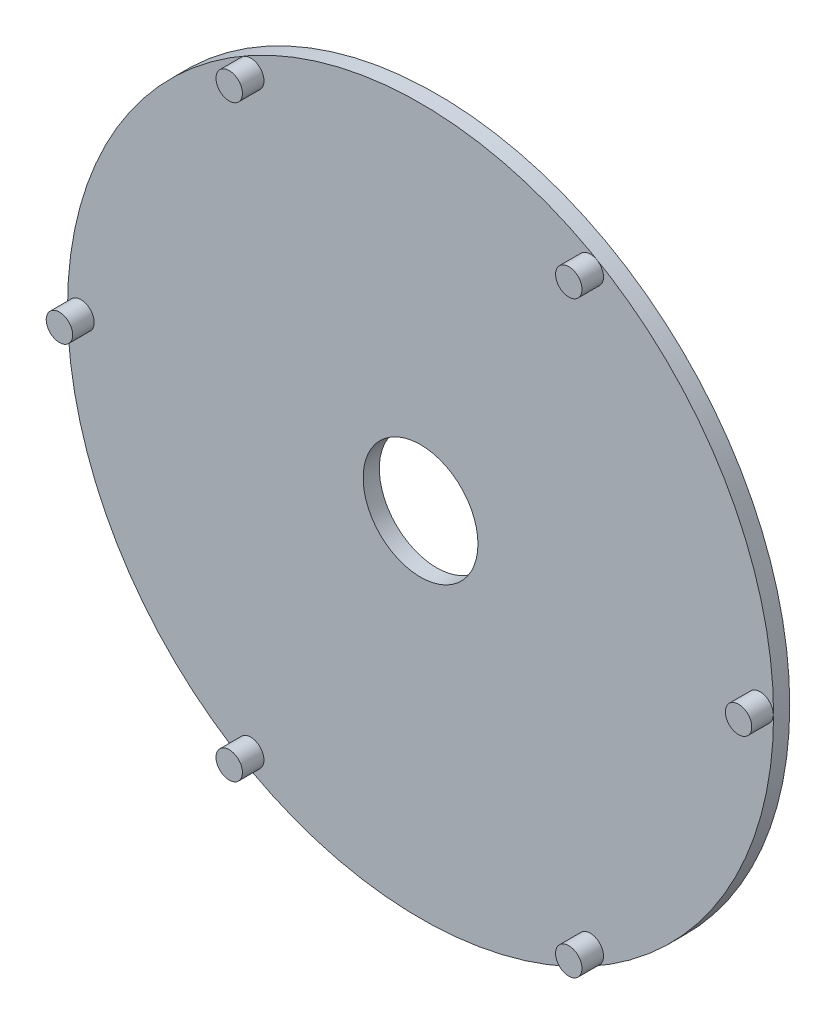
from build123d import *

# Parameters (mm, degrees)
SKETCH_1_R          = 65.5
EXTRUDE_1_DEPTH     = 3
SKETCH_2_R          = 2.45
EXTRUDE_2_DEPTH     = 4
SKETCH_3_R          = 10.65
CUT_EXTRUDE_1_DEPTH = 93.717312299


with BuildPart() as part:
    # 草图1 → 凸台-拉伸1 (new body)
    with BuildSketch(Plane.XY):
        Circle(SKETCH_1_R)
    extrude(amount=-EXTRUDE_1_DEPTH)

    # 草图2 → 凸台-拉伸2 (add)
    with BuildSketch(Plane.XY):
        with Locations((-63, 0)):
            Circle(SKETCH_2_R)
        with Locations((-31.5, 54.559600438)):
            Circle(SKETCH_2_R)
        with Locations((31.5, 54.559600438)):
            Circle(SKETCH_2_R)
        with Locations((63, 0)):
            Circle(SKETCH_2_R)
        with Locations((31.5, -54.559600438)):
            Circle(SKETCH_2_R)
        with Locations((-31.5, -54.559600438)):
            Circle(SKETCH_2_R)
    extrude(amount=EXTRUDE_2_DEPTH)

    # 草图3 → 切除-拉伸1 (cut, through all)
    with BuildSketch(Plane.XY):
        Circle(SKETCH_3_R)
    extrude(amount=-CUT_EXTRUDE_1_DEPTH, mode=Mode.SUBTRACT)


solid = part.part
